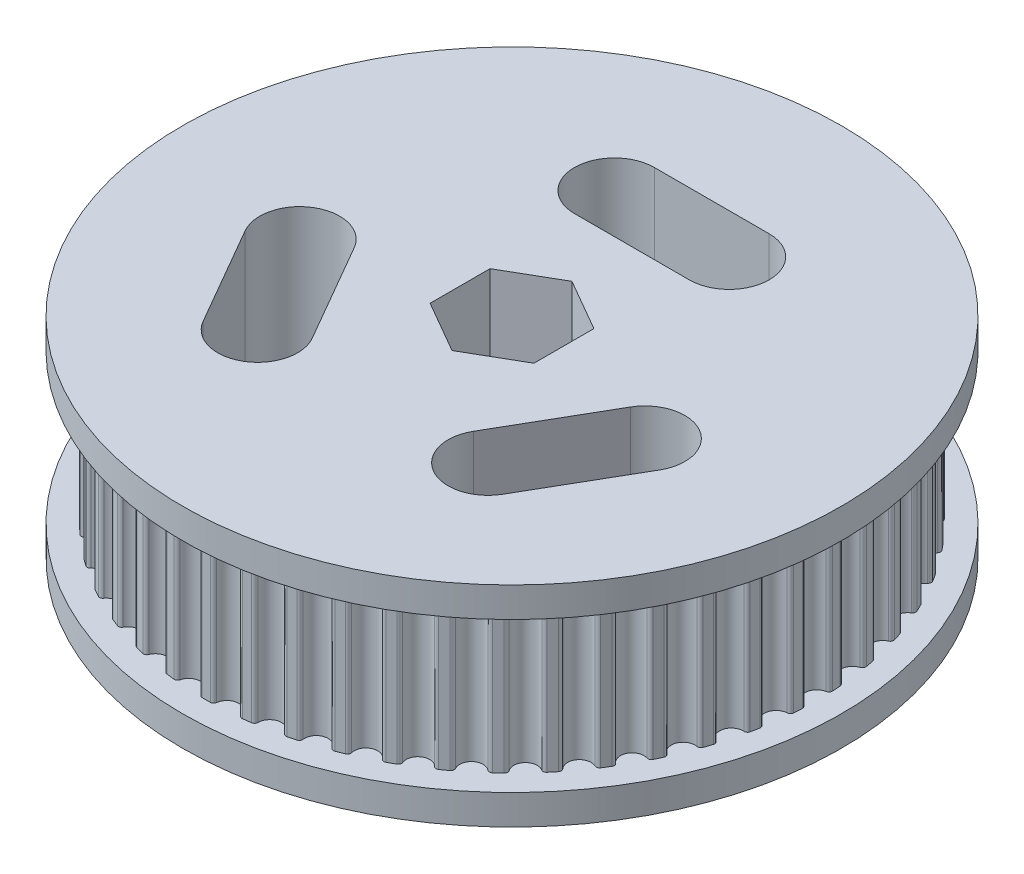
from build123d import *

# Parameters (mm, degrees)
MOUNTINGHOLES_R         = 39.751
BOSS_EXTRUDE1_DEPTH     = 9.525
CUT_EXTRUDE1_DEPTH      = 19.05
CIRPATTERN1_COUNT       = 50
FLANGE_R                = 41.91
BOSS_EXTRUDE2_DEPTH     = 3.81
BOSS_EXTRUDE3_START     = 3.81
SKETCH6_R               = 41.91
BOSS_EXTRUDE3_DEPTH     = 3.81
CUT_EXTRUDE5_DEPTH      = 32.512
CUT_EXTRUDE5_DEPTH_BACK = 31.242


with BuildPart() as part:
    # mountingHoles → Boss-Extrude1 (new, symmetric)
    with BuildSketch(Plane(origin=(0, 0, 0), x_dir=(1, 0, 0), z_dir=(0, 1, 0))):
        Circle(MOUNTINGHOLES_R)
    extrude(amount=BOSS_EXTRUDE1_DEPTH, both=True)

    # Sketch2 → Cut-Extrude1 (cut)
    with BuildSketch(Plane(origin=(0, 9.525, 0), x_dir=(1, 0, 0), z_dir=(0, 1, 0))):
        with BuildLine():
            Line((0, 38.8874), (0, 39.751))
            ThreePointArc((0, 39.751), (2.495985942, 39.672560482), (4.982121367, 39.437551492))
            Line((4.982121367, 39.437551492), (4.873883587, 38.580761236))
            ThreePointArc((4.873883587, 38.580761236), (4.614115167, 38.612689883), (4.354137743, 38.642869501))
            ThreePointArc((4.354137743, 38.642869501), (4.059877913, 38.568719188), (3.887072562, 38.319268939))
            ThreePointArc((3.887072562, 38.319268939), (2.339778754, 37.18971833), (0.94625605, 38.504289431))
            ThreePointArc((0.94625605, 38.504289431), (0.806077727, 38.773430944), (0.523431722, 38.883877096))
            ThreePointArc((0.523431722, 38.883877096), (0.261721789, 38.886519264), (0, 38.8874))
        make_face()
    cut_extrude1 = extrude(amount=-CUT_EXTRUDE1_DEPTH, mode=Mode.SUBTRACT)

    # CirPattern1: Cut-Extrude1 ×50 about axis
    cirpattern1_axis = Axis((0, 9.525, 0), (0, -1, 0))
    for i in range(1, CIRPATTERN1_COUNT):
        add(cut_extrude1.rotate(cirpattern1_axis, i * 360 / CIRPATTERN1_COUNT), mode=Mode.SUBTRACT)

    # flange → Boss-Extrude2 (add)
    with BuildSketch(Plane(origin=(0, 9.525, 0), x_dir=(1, 0, 0), z_dir=(0, 1, 0))):
        Circle(FLANGE_R)
    extrude(amount=BOSS_EXTRUDE2_DEPTH)

    # Sketch6 → Boss-Extrude3 (add)
    with BuildSketch(Plane.XZ.offset(9.525).offset(BOSS_EXTRUDE3_START)):
        Circle(SKETCH6_R)
    extrude(amount=-BOSS_EXTRUDE3_DEPTH)

    # Sketch1<5> → Cut-Extrude5 (cut, two sides: drawn at the far end of the back side and taken through both)
    with BuildSketch(Plane(origin=(0, 0, 0), x_dir=(1, 0, 0), z_dir=(0, 1, 0)).offset(-CUT_EXTRUDE5_DEPTH_BACK)):
        Polygon((0, 7.625642355), (-6.604, 3.812821178), (-6.604, -3.812821178), (0, -7.625642355), (6.604, -3.812821178), (6.604, 3.812821178), align=None)
        with BuildLine():
            Line((-7.3025, 25.405642355), (7.3025, 25.405642355))
            ThreePointArc((7.3025, 25.405642355), (12.3825, 20.325642355), (7.3025, 15.245642355))
            Line((7.3025, 15.245642355), (-7.3025, 15.245642355))
            ThreePointArc((-7.3025, 15.245642355), (-12.3825, 20.325642355), (-7.3025, 25.405642355))
        make_face()
        with BuildLine():
            Line((17.552863577, -2.508508156), (10.250363577, -15.156809178))
            ThreePointArc((10.250363577, -15.156809178), (12.109772628, -22.096218229), (19.049181679, -20.236809178))
            Line((19.049181679, -20.236809178), (26.351681679, -7.588508156))
            ThreePointArc((26.351681679, -7.588508156), (24.492272628, -0.649099104), (17.552863577, -2.508508156))
        make_face()
        with BuildLine():
            Line((-10.250363577, -15.156809178), (-17.552863577, -2.508508156))
            ThreePointArc((-17.552863577, -2.508508156), (-24.492272628, -0.649099104), (-26.351681679, -7.588508156))
            Line((-26.351681679, -7.588508156), (-19.049181679, -20.236809178))
            ThreePointArc((-19.049181679, -20.236809178), (-12.109772628, -22.096218229), (-10.250363577, -15.156809178))
        make_face()
    extrude(amount=CUT_EXTRUDE5_DEPTH + CUT_EXTRUDE5_DEPTH_BACK, mode=Mode.SUBTRACT)


solid = part.part
